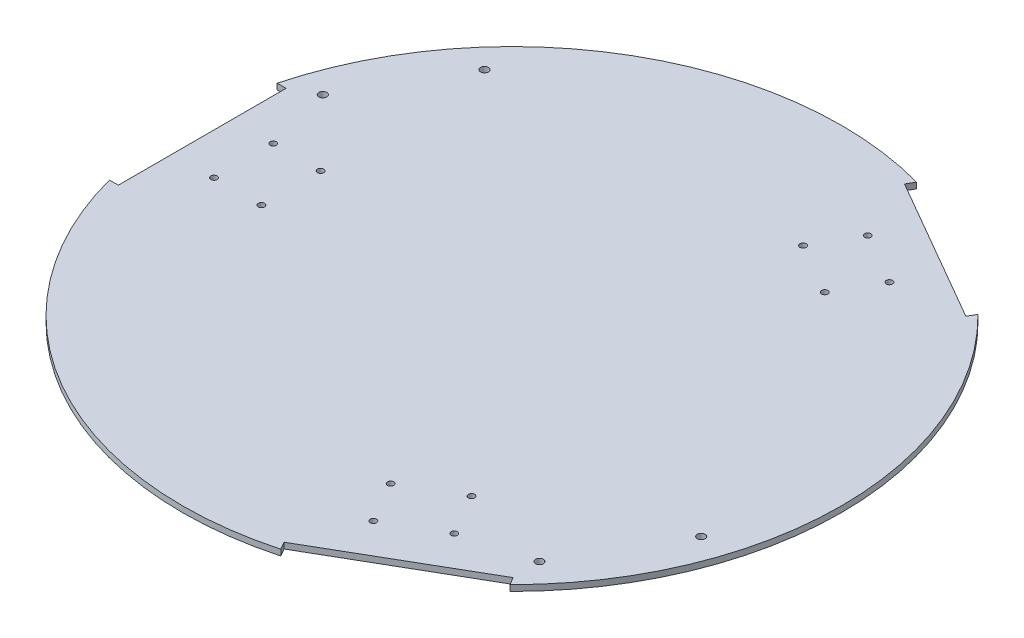
from build123d import *

# Parameters (mm, degrees)
SKETCH_2_R               = 167
EXTRUDE_1_DEPTH          = 3
CUT_EXTRUDE_3_REACH      = 238.193
SKETCH_1_R               = 1.6
PATTERN_CIRCULAR_1_COUNT = 3
CUT_EXTRUDE_4_REACH      = 238.193
SKETCH_3_W               = 90.124680173
SKETCH_3_H               = 85
PATTERN_CIRCULAR_2_COUNT = 3
SKETCH_4_R               = 2
CUT_EXTRUDE_5_DEPTH      = 10
MIRROR_2_COPY_1_SKETCH_R = 2
MIRROR_2_COPY_1_DEPTH    = 10


with BuildPart() as part:
    # 草图2 → 凸台-拉伸1 (new body)
    with BuildSketch(Plane(origin=(0, 0, 0), x_dir=(1, 0, 0), z_dir=(0, 1, 0))):
        Circle(SKETCH_2_R)
    extrude(amount=EXTRUDE_1_DEPTH)

    # 草图1 → 切除-拉伸3 (cut, up to next)
    with BuildSketch(Plane(origin=(0, 0, 0), x_dir=(1, 0, 0), z_dir=(0, 1, 0)), mode=Mode.PRIVATE) as cut_extrude_3_sk1:
        with Locations((-112, 15)):
            Circle(SKETCH_1_R)
    cut_extrude_3_tool1 = extrude(cut_extrude_3_sk1.sketch, amount=CUT_EXTRUDE_3_REACH, mode=Mode.PRIVATE) & part.part
    # 草图1 → 切除-拉伸3 (cut, up to next)
    with BuildSketch(Plane(origin=(0, 0, 0), x_dir=(1, 0, 0), z_dir=(0, 1, 0)), mode=Mode.PRIVATE) as cut_extrude_3_sk2:
        with Locations((-112, -15)):
            Circle(SKETCH_1_R)
    cut_extrude_3_tool2 = extrude(cut_extrude_3_sk2.sketch, amount=CUT_EXTRUDE_3_REACH, mode=Mode.PRIVATE) & part.part
    # 草图1 → 切除-拉伸3 (cut, up to next)
    with BuildSketch(Plane(origin=(0, 0, 0), x_dir=(1, 0, 0), z_dir=(0, 1, 0)), mode=Mode.PRIVATE) as cut_extrude_3_sk3:
        with Locations((-136, 15)):
            Circle(SKETCH_1_R)
    cut_extrude_3_tool3 = extrude(cut_extrude_3_sk3.sketch, amount=CUT_EXTRUDE_3_REACH, mode=Mode.PRIVATE) & part.part
    # 草图1 → 切除-拉伸3 (cut, up to next)
    with BuildSketch(Plane(origin=(0, 0, 0), x_dir=(1, 0, 0), z_dir=(0, 1, 0)), mode=Mode.PRIVATE) as cut_extrude_3_sk4:
        with Locations((-136, -15)):
            Circle(SKETCH_1_R)
    cut_extrude_3_tool4 = extrude(cut_extrude_3_sk4.sketch, amount=CUT_EXTRUDE_3_REACH, mode=Mode.PRIVATE) & part.part
    cut_extrude_3_1 = cut_extrude_3_tool1.solids().sort_by_distance((-112, 0, -15))[0]
    add(cut_extrude_3_1, mode=Mode.SUBTRACT)
    cut_extrude_3_2 = cut_extrude_3_tool2.solids().sort_by_distance((-112, 0, 15))[0]
    add(cut_extrude_3_2, mode=Mode.SUBTRACT)
    cut_extrude_3_3 = cut_extrude_3_tool3.solids().sort_by_distance((-136, 0, -15))[0]
    add(cut_extrude_3_3, mode=Mode.SUBTRACT)
    cut_extrude_3_4 = cut_extrude_3_tool4.solids().sort_by_distance((-136, 0, 15))[0]
    add(cut_extrude_3_4, mode=Mode.SUBTRACT)
    cut_extrude_3 = cut_extrude_3_1 + cut_extrude_3_2 + cut_extrude_3_3 + cut_extrude_3_4  # 切除-拉伸3 as one shape, for the pattern or mirror that repeats it

    # 阵列(圆周)1: 切除-拉伸3 ×3 about axis
    pattern_circular_1_axis = Axis((0, 81.400407757, 0), (0, -1, 0))
    for i in range(1, PATTERN_CIRCULAR_1_COUNT):
        add(cut_extrude_3.rotate(pattern_circular_1_axis, i * 360 / PATTERN_CIRCULAR_1_COUNT), mode=Mode.SUBTRACT)

    # 草图3 → 切除-拉伸4 (cut, up to next)
    with BuildSketch(Plane(origin=(0, 3, 0), x_dir=(1, 0, 0), z_dir=(0, 1, 0)), mode=Mode.PRIVATE) as cut_extrude_4_sk1:
        with Locations((-202.062340087, 0)):
            Rectangle(SKETCH_3_W, SKETCH_3_H)
    cut_extrude_4_tool1 = extrude(cut_extrude_4_sk1.sketch, amount=-CUT_EXTRUDE_4_REACH, mode=Mode.PRIVATE) & part.part
    cut_extrude_4 = cut_extrude_4_tool1.solids().sort_by_distance((-202.06234, 3, 0))[0]
    add(cut_extrude_4, mode=Mode.SUBTRACT)

    # 阵列(圆周)2: 切除-拉伸4 ×3 about axis
    pattern_circular_2_axis = Axis((0, 81.400407757, 0), (0, -1, 0))
    for i in range(1, PATTERN_CIRCULAR_2_COUNT):
        add(cut_extrude_4.rotate(pattern_circular_2_axis, i * 360 / PATTERN_CIRCULAR_2_COUNT), mode=Mode.SUBTRACT)

    # 草图4 → 切除-拉伸5 (cut)
    with BuildSketch(Plane.XZ):
        with Locations((-144.903810568, -49.019237886)):
            Circle(SKETCH_4_R)
    cut_extrude_5 = extrude(amount=-CUT_EXTRUDE_5_DEPTH, mode=Mode.SUBTRACT)

    # 镜向1: 切除-拉伸5 across plane
    add(cut_extrude_5.mirror(Plane(origin=(0, 0, 0), x_dir=(0.8660254037844363, 0, 0.500000000000004), z_dir=(0.5000000000000042, 0, -0.8660254037844363))), mode=Mode.SUBTRACT)

    # 镜向2: 切除-拉伸5 across plane
    add(cut_extrude_5.mirror(Plane(origin=(0, 0, 0), x_dir=(-0.500000000000004, 0, 0.8660254037844363), z_dir=(-0.8660254037844365, 0, -0.500000000000004))), mode=Mode.SUBTRACT)

    # 镜向2 copy 1 sketch → 镜向2 copy 1 (cut)
    with BuildSketch(Plane(origin=(0, 0, 0), x_dir=(-1, 0, 0), z_dir=(0, -1, 0))):
        with Locations((-144.903810568, -49.019237886)):
            Circle(MIRROR_2_COPY_1_SKETCH_R)
    extrude(amount=-MIRROR_2_COPY_1_DEPTH, mode=Mode.SUBTRACT)


solid = part.part
